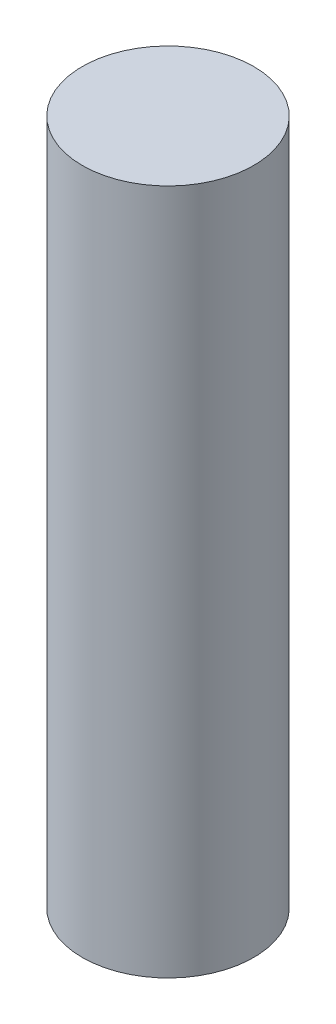
from build123d import *

# Parameters (mm, degrees)
SKETCH1_R           = 0.75
BOSS_EXTRUDE1_DEPTH = 6


with BuildPart() as part:
    # Sketch1 → Boss-Extrude1 (new body)
    with BuildSketch(Plane(origin=(0, 0, 0), x_dir=(1, 0, 0), z_dir=(0, 1, 0))):
        Circle(SKETCH1_R)
    extrude(amount=BOSS_EXTRUDE1_DEPTH)


solid = part.part
